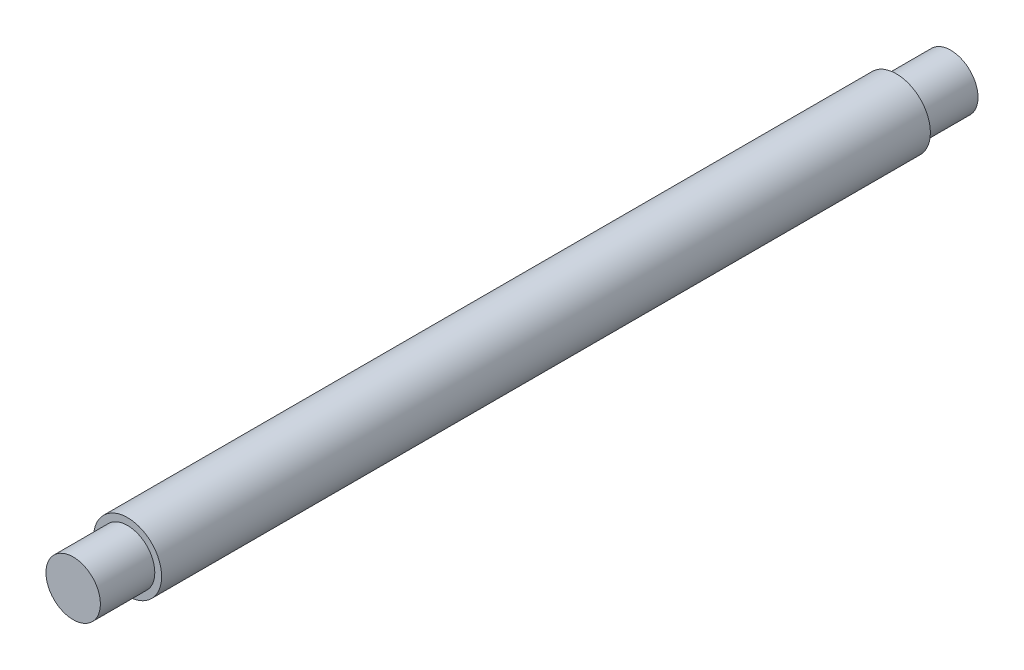
from build123d import *

# Parameters (mm, degrees)
SKETCH1_R           = 5
BOSS_EXTRUDE1_DEPTH = 56.5
SKETCH1_3_R         = 4
BOSS_EXTRUDE2_DEPTH = 64.5


with BuildPart() as part:
    # Sketch1 → Boss-Extrude1 (new, symmetric)
    with BuildSketch(Plane.XY):
        Circle(SKETCH1_R)
    extrude(amount=BOSS_EXTRUDE1_DEPTH, both=True)

    # Sketch1<3> → Boss-Extrude2 (add, symmetric)
    with BuildSketch(Plane.XY):
        Circle(SKETCH1_3_R)
    extrude(amount=BOSS_EXTRUDE2_DEPTH, both=True)


solid = part.part
